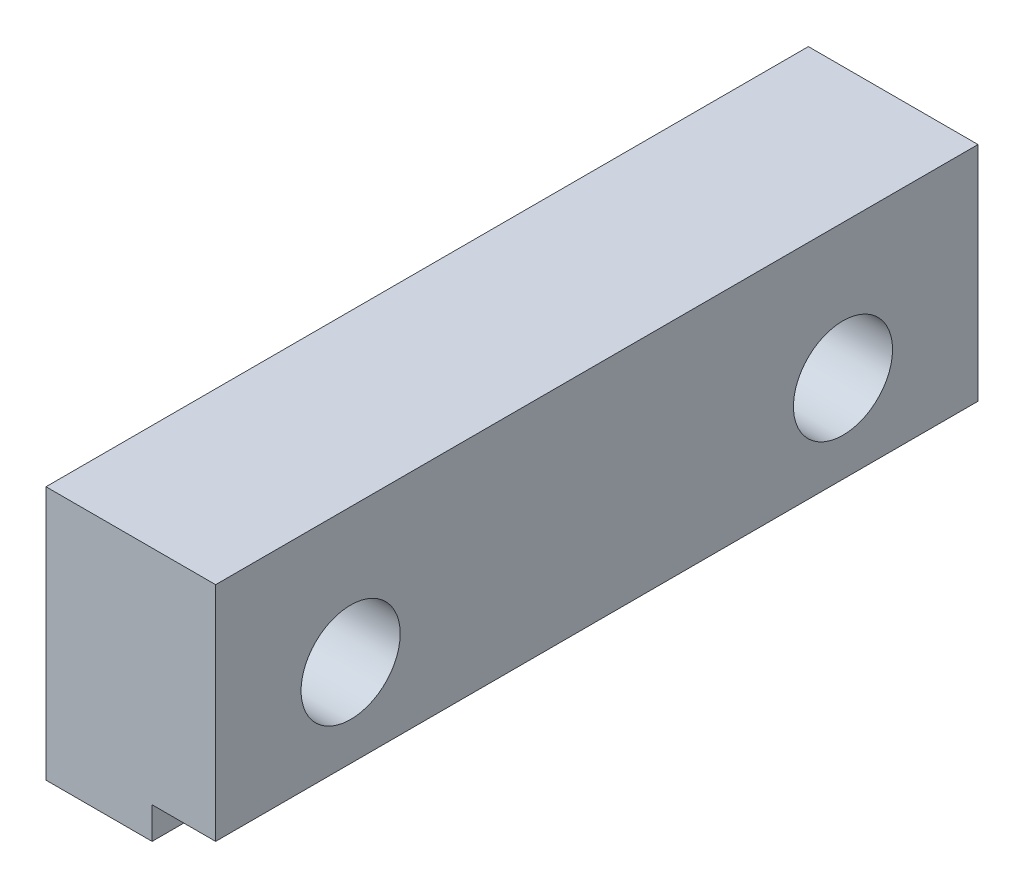
from build123d import *

# Parameters (mm, degrees)
SKETCH1_W           = 33.909
SKETCH1_H           = 50.8
BOSS_EXTRUDE1_DEPTH = 76.2
CUT_EXTRUDE1_REACH  = 89.186
SKETCH2_R           = 6.731
SKETCH3_R           = 9.906
CUT_EXTRUDE2_DEPTH  = 28.956
SKETCH4_W           = 4.494494968
SKETCH4_H           = 6.35
CUT_EXTRUDE4_DEPTH  = 156.42964669
SKETCH5_W           = 152.4
SKETCH5_H           = 6.35
CUT_EXTRUDE5_DEPTH  = 12.7


with BuildPart() as part:
    # Sketch1 → Boss-Extrude1 (new, symmetric)
    with BuildSketch(Plane.XY):
        Rectangle(SKETCH1_W, SKETCH1_H)
    extrude(amount=BOSS_EXTRUDE1_DEPTH, both=True)

    # Sketch2 → Cut-Extrude1 (cut, up to next)
    with BuildSketch(Plane(origin=(16.9545, 0, 0), x_dir=(0, 0, -1), z_dir=(1, 0, 0)), mode=Mode.PRIVATE) as cut_extrude1_sk1:
        with Locations((-49.2125, -1.524)):
            Circle(SKETCH2_R)
    cut_extrude1_tool1 = extrude(cut_extrude1_sk1.sketch, amount=-CUT_EXTRUDE1_REACH, mode=Mode.PRIVATE) & part.part
    # Sketch2 → Cut-Extrude1 (cut, up to next)
    with BuildSketch(Plane(origin=(16.9545, 0, 0), x_dir=(0, 0, -1), z_dir=(1, 0, 0)), mode=Mode.PRIVATE) as cut_extrude1_sk2:
        with Locations((49.2125, -1.524)):
            Circle(SKETCH2_R)
    cut_extrude1_tool2 = extrude(cut_extrude1_sk2.sketch, amount=-CUT_EXTRUDE1_REACH, mode=Mode.PRIVATE) & part.part
    add(cut_extrude1_tool1.solids().sort_by_distance((16.9545, -1.524, 49.2125))[0], mode=Mode.SUBTRACT)
    add(cut_extrude1_tool2.solids().sort_by_distance((16.9545, -1.524, -49.2125))[0], mode=Mode.SUBTRACT)

    # Sketch3 → Cut-Extrude2 (cut)
    with BuildSketch(Plane(origin=(16.9545, 0, 0), x_dir=(0, 0, -1), z_dir=(1, 0, 0))):
        with Locations((-49.2125, -1.524)):
            Circle(SKETCH3_R)
        with Locations((49.2125, -1.524)):
            Circle(SKETCH3_R)
    extrude(amount=-CUT_EXTRUDE2_DEPTH, mode=Mode.SUBTRACT)

    # Sketch4 → Cut-Extrude4 (cut, through all)
    with BuildSketch(Plane.XY.offset(76.2)):
        with Locations((14.707252516, -22.225)):
            Rectangle(SKETCH4_W, SKETCH4_H)
    extrude(amount=-CUT_EXTRUDE4_DEPTH, mode=Mode.SUBTRACT)

    # Sketch5 → Cut-Extrude5 (cut)
    with BuildSketch(Plane(origin=(16.9545, 0, 0), x_dir=(0, 0, -1), z_dir=(1, 0, 0))):
        with Locations((0, -22.225)):
            Rectangle(SKETCH5_W, SKETCH5_H)
    extrude(amount=-CUT_EXTRUDE5_DEPTH, mode=Mode.SUBTRACT)


solid = part.part
